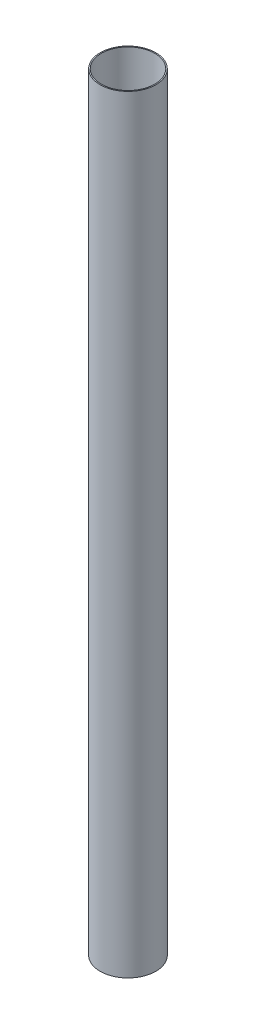
from build123d import *

# Parameters (mm, degrees)
SKETCH1_R           = 51.562
SKETCH1_R_2         = 49.53
BOSS_EXTRUDE1_DEPTH = 1422.4


with BuildPart() as part:
    # Sketch1 → Boss-Extrude1 (new body)
    with BuildSketch(Plane(origin=(0, 0, 0), x_dir=(1, 0, 0), z_dir=(0, 1, 0))):
        with Locations(Location((0, 0, 0), (0, 0, 270))):
            Circle(SKETCH1_R)
        with Locations(Location((0, 0, 0), (0, 0, 270))):
            Circle(SKETCH1_R_2, mode=Mode.SUBTRACT)
    extrude(amount=BOSS_EXTRUDE1_DEPTH)


solid = part.part
